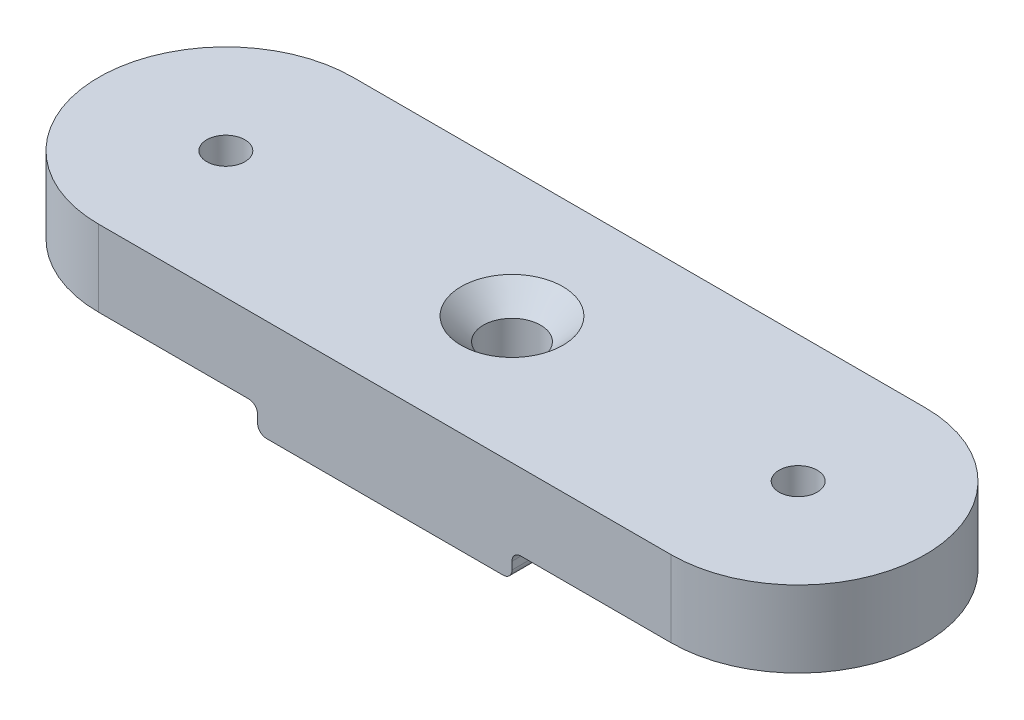
from build123d import *

# Parameters (mm, degrees)
SKETCH1_R           = 1.5
SKETCH1_R_2         = 2.25
BOSS_EXTRUDE1_DEPTH = 8
CHAMFER1_SIZE       = 1.75
CUT_EXTRUDE1_DEPTH  = 2
SKETCH4_R           = 3
CUT_EXTRUDE2_DEPTH  = 3
FILLET1_R           = 0.7
FILLET2_R           = 0.5


with BuildPart() as part:
    # Sketch1 → Boss-Extrude1 (new body)
    with BuildSketch(Plane(origin=(0, 0, 0), x_dir=(1, 0, 0), z_dir=(0, 1, 0))):
        with BuildLine():
            Line((-22.5, 10), (22.5, 10))
            ThreePointArc((22.5, 10), (32.5, 0), (22.5, -10))
            Line((22.5, -10), (-22.5, -10))
            ThreePointArc((-22.5, -10), (-32.5, 0), (-22.5, 10))
        make_face()
        with Locations(Location((-22.5, 0, 0), (0, 0, 270))):
            Circle(SKETCH1_R, mode=Mode.SUBTRACT)
        with Locations(Location((22.5, 0, 0), (0, 0, 270))):
            Circle(SKETCH1_R, mode=Mode.SUBTRACT)
        with Locations(Location((0, 0, 0), (0, 0, 270))):
            Circle(SKETCH1_R_2, mode=Mode.SUBTRACT)
    extrude(amount=BOSS_EXTRUDE1_DEPTH)

    # Chamfer1
    chamfer1_edges = [part.edges().sort_by_distance(p)[0] for p in [
        (0, 8, -2.25),
    ]]
    chamfer(chamfer1_edges, length=CHAMFER1_SIZE)

    # Sketch3 → Cut-Extrude1 (cut)
    with BuildSketch(Plane.XZ):
        with BuildLine():
            Line((-10, 10), (-22.5, 10))
            ThreePointArc((-22.5, 10), (-32.5, 0), (-22.5, -10))
            Line((-22.5, -10), (-10, -10))
            Line((-10, -10), (-10, 10))
        make_face()
        with BuildLine():
            Line((22.5, 10), (10, 10))
            Line((10, 10), (10, -10))
            Line((10, -10), (22.5, -10))
            ThreePointArc((22.5, -10), (32.5, 0), (22.5, 10))
        make_face()
    extrude(amount=-CUT_EXTRUDE1_DEPTH, mode=Mode.SUBTRACT)

    # Sketch4 → Cut-Extrude2 (cut)
    with BuildSketch(Plane.XZ.offset(-2)):
        with Locations(Location((-22.5, 0, 0), (0, 0, 270))):
            Circle(SKETCH4_R)
        with Locations(Location((22.5, 0, 0), (0, 0, 270))):
            Circle(SKETCH4_R)
    extrude(amount=-CUT_EXTRUDE2_DEPTH, mode=Mode.SUBTRACT)

    # Fillet1
    fillet1_edges = [part.edges().sort_by_distance(p)[0] for p in [
        (-10, 0, 0),
        (-10, 2, 0),
        (10, 0, 0),
        (10, 2, 0),
    ]]
    fillet(fillet1_edges, radius=FILLET1_R)

    # Fillet2
    fillet2_edges = [part.edges().sort_by_distance(p)[0] for p in [
        (-22.5, 2, 3),
        (22.5, 2, 3),
    ]]
    fillet(fillet2_edges, radius=FILLET2_R)


solid = part.part
